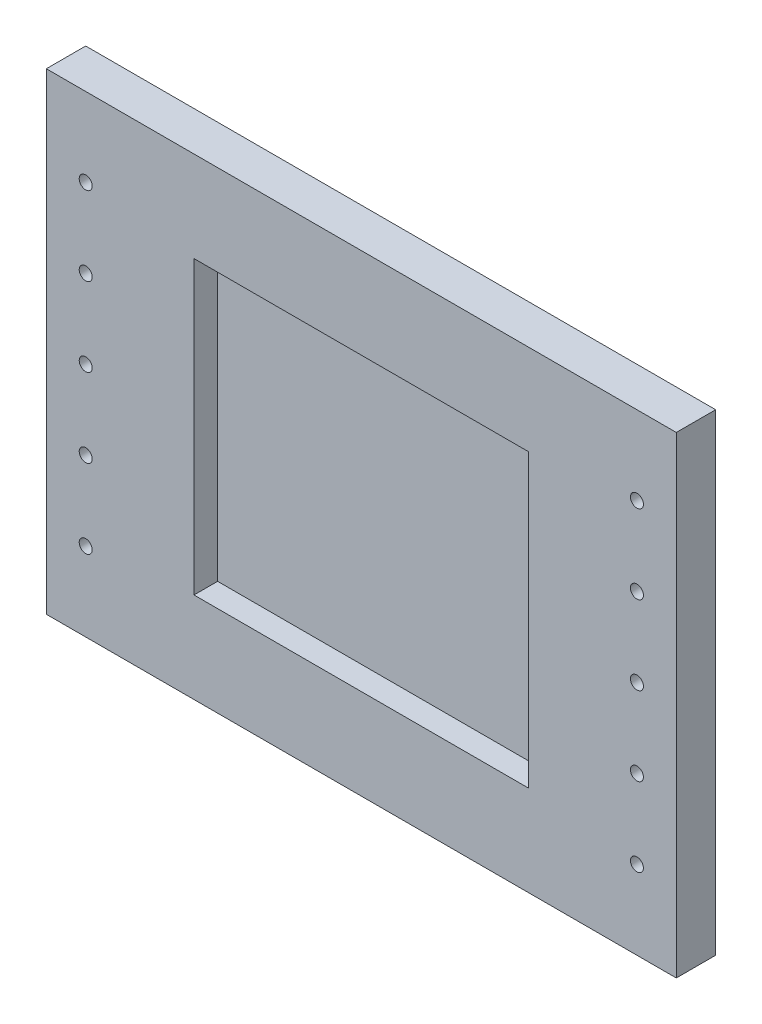
from build123d import *

# Parameters (mm, degrees)
SKETCH_1_W          = 160
SKETCH_1_H          = 120
EXTRUDE_1_DEPTH     = 10
SKETCH_2_W          = 85
SKETCH_2_H          = 74
CUT_EXTRUDE_1_DEPTH = 6
SKETCH_3_R          = 1.65
CUT_EXTRUDE_2_DEPTH = 101.498756211


with BuildPart() as part:
    # 草图1 → 凸台-拉伸1 (new body)
    with BuildSketch(Plane.XY):
        Rectangle(SKETCH_1_W, SKETCH_1_H)
    extrude(amount=EXTRUDE_1_DEPTH)

    # 草图2 → 切除-拉伸1 (cut)
    with BuildSketch(Plane.XY.offset(10)):
        Rectangle(SKETCH_2_W, SKETCH_2_H)
    extrude(amount=-CUT_EXTRUDE_1_DEPTH, mode=Mode.SUBTRACT)

    # 草图3 → 切除-拉伸2 (cut, through all)
    with BuildSketch(Plane(origin=(0, 0, 0), x_dir=(-1, 0, 0), z_dir=(0, 0, -1))):
        with Locations((-70, 40)):
            Circle(SKETCH_3_R)
        with Locations((-70, 20)):
            Circle(SKETCH_3_R)
        with Locations((-70, 0)):
            Circle(SKETCH_3_R)
        with Locations((-70, -20)):
            Circle(SKETCH_3_R)
        with Locations((-70, -40)):
            Circle(SKETCH_3_R)
    cut_extrude_2 = extrude(amount=-CUT_EXTRUDE_2_DEPTH, mode=Mode.SUBTRACT)

    # 镜向1: 切除-拉伸2 across plane
    add(cut_extrude_2.mirror(Plane(origin=(0, 0, 0), x_dir=(0, 0, 1), z_dir=(1, 0, 0))), mode=Mode.SUBTRACT)


solid = part.part
